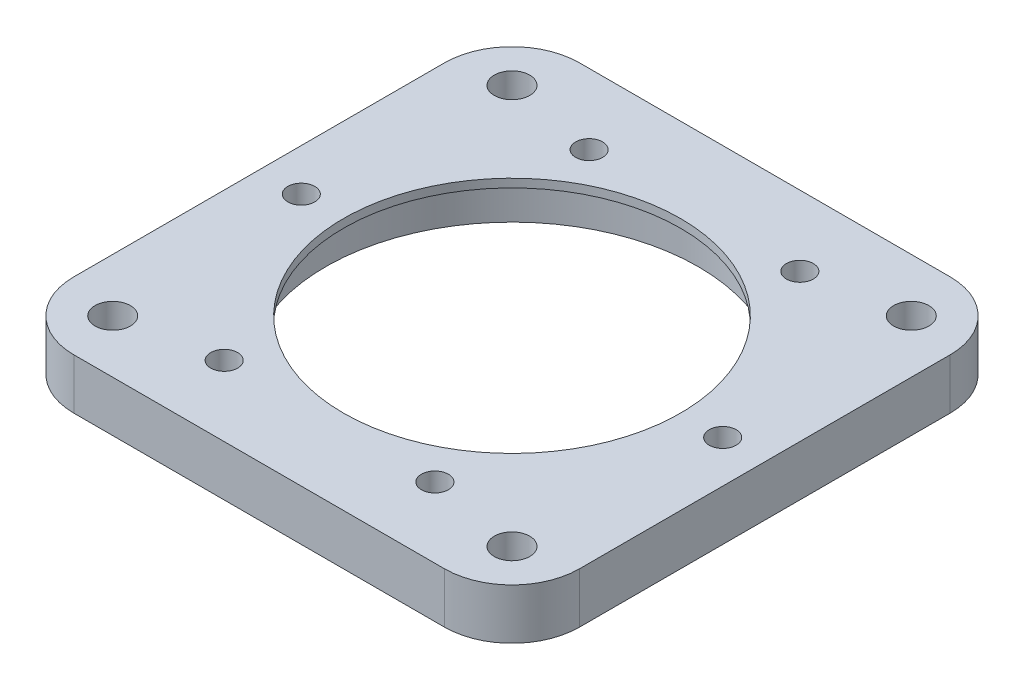
from build123d import *

# Parameters (mm, degrees)
SKETCH_1_W          = 60
SKETCH_1_H          = 60
SKETCH_1_R          = 20
EXTRUDE_1_DEPTH     = 6
SKETCH_3_R          = 22.1
CUT_EXTRUDE_1_DEPTH = 5
SKETCH_4_R          = 1.6
SKETCH_4_R_2        = 2.1
CUT_EXTRUDE_2_DEPTH = 6
FILLET_1_R          = 8


with BuildPart() as part:
    # 草图1 → 凸台-拉伸1 (new body)
    with BuildSketch(Plane(origin=(0, 0, 0), x_dir=(1, 0, 0), z_dir=(0, 1, 0))):
        Rectangle(SKETCH_1_W, SKETCH_1_H)
        with Locations(Location((0, 0, 0), (0, 0, 270))):
            Circle(SKETCH_1_R, mode=Mode.SUBTRACT)
    extrude(amount=EXTRUDE_1_DEPTH)

    # 草图3 → 切除-拉伸1 (cut)
    with BuildSketch(Plane.XZ):
        with Locations(Location((0, 0, 0), (0, 0, 270))):
            Circle(SKETCH_3_R)
    extrude(amount=-CUT_EXTRUDE_1_DEPTH, mode=Mode.SUBTRACT)

    # 草图4 → 切除-拉伸2 (cut)
    with BuildSketch(Plane(origin=(0, 6, 0), x_dir=(1, 0, 0), z_dir=(0, 1, 0))):
        with Locations(Location((25, 0, 0), (0, 0, 270))):
            Circle(SKETCH_4_R)
        with Locations(Location((12.5, -21.650635095, 0), (0, 0, 270))):
            Circle(SKETCH_4_R)
        with Locations(Location((-12.5, -21.650635095, 0), (0, 0, 270))):
            Circle(SKETCH_4_R)
        with Locations(Location((-25, 0, 0), (0, 0, 270))):
            Circle(SKETCH_4_R)
        with Locations(Location((-12.5, 21.650635095, 0), (0, 0, 270))):
            Circle(SKETCH_4_R)
        with Locations(Location((12.5, 21.650635095, 0), (0, 0, 270))):
            Circle(SKETCH_4_R)
        with Locations(Location((23.68807717, 23.68807717, 0), (0, 0, 270))):
            Circle(SKETCH_4_R_2)
        with Locations(Location((23.68807717, -23.68807717, 0), (0, 0, 270))):
            Circle(SKETCH_4_R_2)
        with Locations(Location((-23.68807717, -23.68807717, 0), (0, 0, 270))):
            Circle(SKETCH_4_R_2)
        with Locations(Location((-23.68807717, 23.68807717, 0), (0, 0, 270))):
            Circle(SKETCH_4_R_2)
    extrude(amount=-CUT_EXTRUDE_2_DEPTH, mode=Mode.SUBTRACT)

    # 圆角1
    fillet_1_edges = [part.edges().sort_by_distance(p)[0] for p in [
        (30, 3, 30),
        (-30, 3, 30),
        (-30, 3, -30),
        (30, 3, -30),
    ]]
    fillet(fillet_1_edges, radius=FILLET_1_R)


solid = part.part
